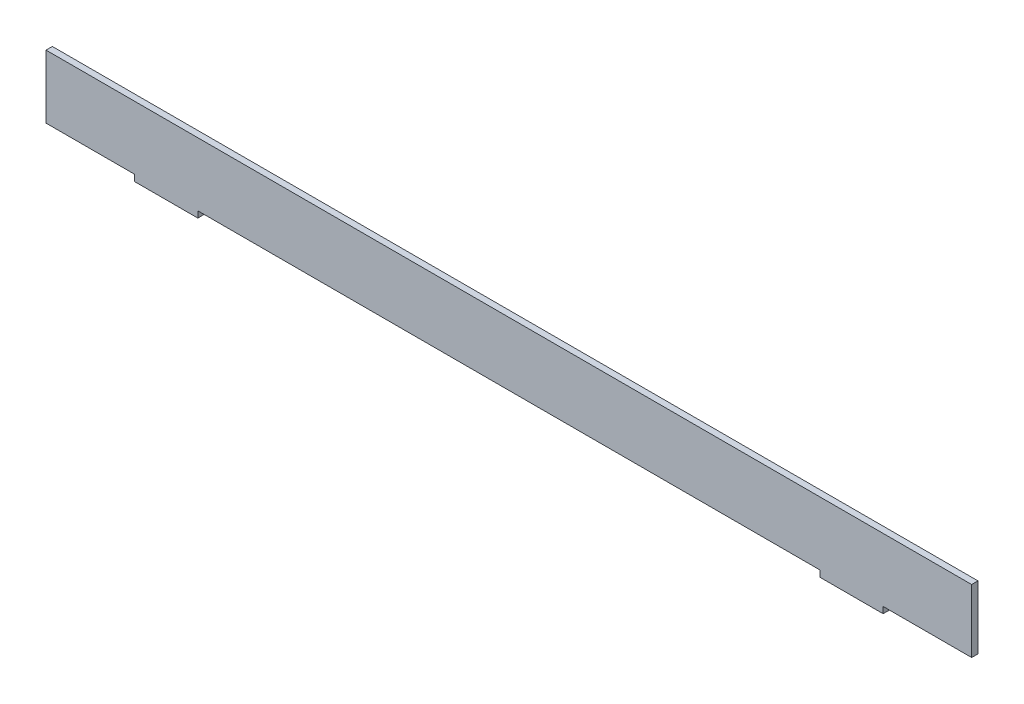
from build123d import *

# Parameters (mm, degrees)
SALIENTE_EXTRUIR1_DEPTH = 1.5


with BuildPart() as part:
    # Croquis1 → Saliente-Extruir1 (new, symmetric)
    with BuildSketch(Plane.XY):
        Polygon((-177.5, -15), (-177.5, -18), (-147.5, -18), (-147.5, -15), (147.5, -15), (147.5, -18), (177.5, -18), (177.5, -15), (219.5, -15), (219.5, 15), (-219.5, 15), (-219.5, -15), align=None)
    extrude(amount=SALIENTE_EXTRUIR1_DEPTH, both=True)


solid = part.part
